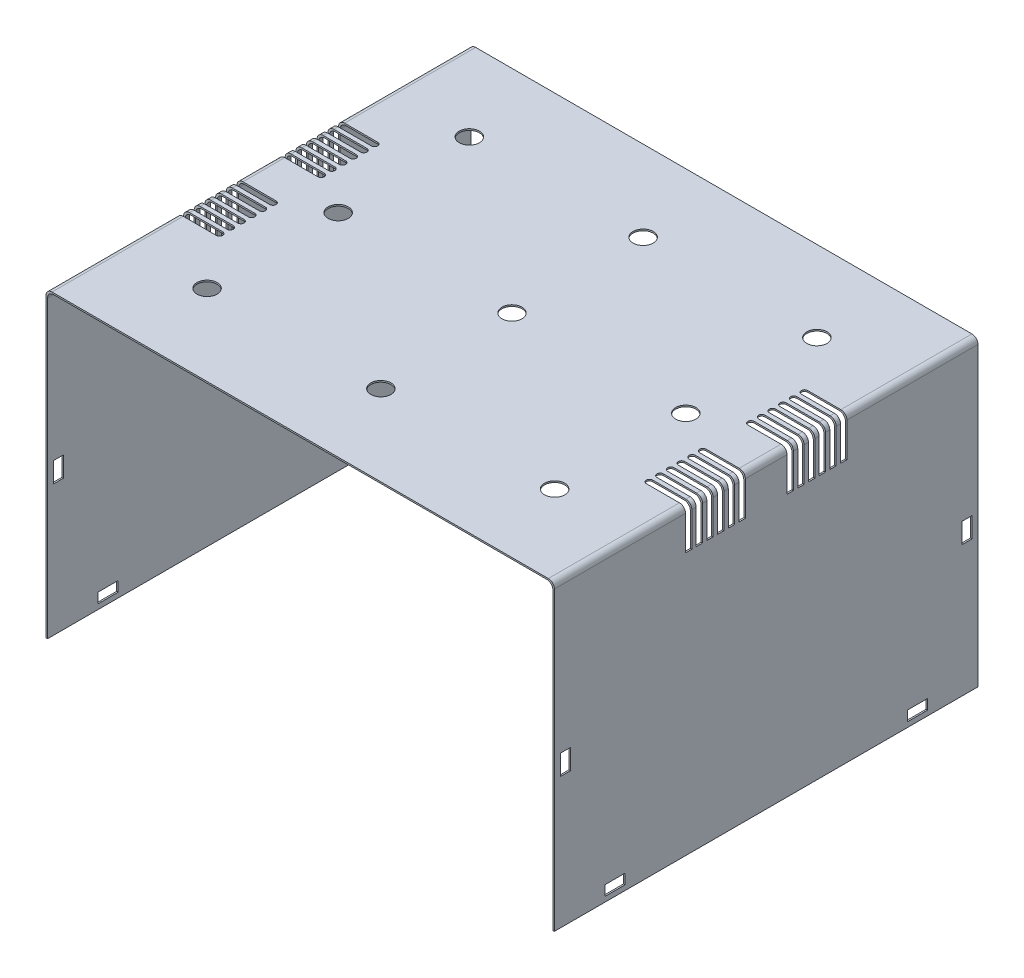
from build123d import *

# Parameters (mm, degrees)
SALIENTE_EXTRUIR1_DEPTH = 210
CORTAR_EXTRUIR3_DEPTH   = 20
CROQUIS5_W              = 10
CROQUIS5_H              = 5
CROQUIS5_W_2            = 5
CROQUIS5_H_2            = 10
CORTAR_EXTRUIR4_DEPTH   = 271
CROQUIS6_R              = 5
CORTAR_EXTRUIR5_DEPTH   = 10


with BuildPart() as part:
    # Croquis1 → Saliente-Extruir1 (new body)
    with BuildSketch(Plane.XY):
        with BuildLine():
            Line((-126, 0), (-126, 147))
            ThreePointArc((-126, 147), (-125.121320344, 149.121320344), (-123, 150))
            Line((-123, 150), (123, 150))
            ThreePointArc((123, 150), (125.121320344, 149.121320344), (126, 147))
            Line((126, 147), (126, 0))
            Line((126, 0), (125.25, 0))
            Line((125.25, 0), (125.25, 146.25))
            ThreePointArc((125.25, 146.25), (124.371320344, 148.371320344), (122.25, 149.25))
            Line((122.25, 149.25), (-122.25, 149.25))
            ThreePointArc((-122.25, 149.25), (-124.371320344, 148.371320344), (-125.25, 146.25))
            Line((-125.25, 146.25), (-125.25, 0))
            Line((-125.25, 0), (-126, 0))
        make_face()
    extrude(amount=-SALIENTE_EXTRUIR1_DEPTH)

    # Croquis4 → Cortar-Extruir3 (cut)
    with BuildSketch(Plane(origin=(0, 150, 0), x_dir=(1, 0, 0), z_dir=(0, 1, 0))):
        with BuildLine():
            Line((-106.575, 94.65), (-128.425, 94.65))
            ThreePointArc((-128.425, 94.65), (-130, 93.075), (-128.425, 91.5))
            Line((-128.425, 91.5), (-106.575, 91.5))
            ThreePointArc((-106.575, 91.5), (-105, 93.075), (-106.575, 94.65))
        make_face()
        with BuildLine():
            Line((-106.575, 145), (-128.425, 145))
            ThreePointArc((-128.425, 145), (-130, 143.425), (-128.425, 141.85))
            Line((-128.425, 141.85), (-106.575, 141.85))
            ThreePointArc((-106.575, 141.85), (-105, 143.425), (-106.575, 145))
        make_face()
        with BuildLine():
            Line((-106.575, 89.35), (-128.425, 89.35))
            ThreePointArc((-128.425, 89.35), (-130, 87.775), (-128.425, 86.2))
            Line((-128.425, 86.2), (-106.575, 86.2))
            ThreePointArc((-106.575, 86.2), (-105, 87.775), (-106.575, 89.35))
        make_face()
        with BuildLine():
            Line((-106.575, 84.05), (-128.425, 84.05))
            ThreePointArc((-128.425, 84.05), (-130, 82.475), (-128.425, 80.9))
            Line((-128.425, 80.9), (-106.575, 80.9))
            ThreePointArc((-106.575, 80.9), (-105, 82.475), (-106.575, 84.05))
        make_face()
        with BuildLine():
            Line((-106.575, 78.75), (-128.425, 78.75))
            ThreePointArc((-128.425, 78.75), (-130, 77.175), (-128.425, 75.6))
            Line((-128.425, 75.6), (-106.575, 75.6))
            ThreePointArc((-106.575, 75.6), (-105, 77.175), (-106.575, 78.75))
        make_face()
        with BuildLine():
            Line((-106.575, 73.45), (-128.425, 73.45))
            ThreePointArc((-128.425, 73.45), (-130, 71.875), (-128.425, 70.3))
            Line((-128.425, 70.3), (-106.575, 70.3))
            ThreePointArc((-106.575, 70.3), (-105, 71.875), (-106.575, 73.45))
        make_face()
        with BuildLine():
            Line((-128.425, 136.55), (-106.575, 136.55))
            ThreePointArc((-106.575, 136.55), (-105, 138.125), (-106.575, 139.7))
            Line((-106.575, 139.7), (-128.425, 139.7))
            ThreePointArc((-128.425, 139.7), (-130, 138.125), (-128.425, 136.55))
        make_face()
        with BuildLine():
            Line((-128.425, 131.25), (-106.575, 131.25))
            ThreePointArc((-106.575, 131.25), (-105, 132.825), (-106.575, 134.4))
            Line((-106.575, 134.4), (-128.425, 134.4))
            ThreePointArc((-128.425, 134.4), (-130, 132.825), (-128.425, 131.25))
        make_face()
        with BuildLine():
            Line((-128.425, 125.95), (-106.575, 125.95))
            ThreePointArc((-106.575, 125.95), (-105, 127.525), (-106.575, 129.1))
            Line((-106.575, 129.1), (-128.425, 129.1))
            ThreePointArc((-128.425, 129.1), (-130, 127.525), (-128.425, 125.95))
        make_face()
        with BuildLine():
            Line((-128.425, 120.65), (-106.575, 120.65))
            ThreePointArc((-106.575, 120.65), (-105, 122.225), (-106.575, 123.8))
            Line((-106.575, 123.8), (-128.425, 123.8))
            ThreePointArc((-128.425, 123.8), (-130, 122.225), (-128.425, 120.65))
        make_face()
        with BuildLine():
            Line((-128.425, 115.35), (-106.575, 115.35))
            ThreePointArc((-106.575, 115.35), (-105, 116.925), (-106.575, 118.5))
            Line((-106.575, 118.5), (-128.425, 118.5))
            ThreePointArc((-128.425, 118.5), (-130, 116.925), (-128.425, 115.35))
        make_face()
        with BuildLine():
            Line((-106.575, 68.15), (-128.425, 68.15))
            ThreePointArc((-128.425, 68.15), (-130, 66.575), (-128.425, 65))
            Line((-128.425, 65), (-106.575, 65))
            ThreePointArc((-106.575, 65), (-105, 66.575), (-106.575, 68.15))
        make_face()
        with BuildLine():
            Line((106.575, 118.5), (128.425, 118.5))
            ThreePointArc((128.425, 118.5), (130, 116.925), (128.425, 115.35))
            Line((128.425, 115.35), (106.575, 115.35))
            ThreePointArc((106.575, 115.35), (105, 116.925), (106.575, 118.5))
        make_face()
        with BuildLine():
            Line((106.575, 123.8), (128.425, 123.8))
            ThreePointArc((128.425, 123.8), (130, 122.225), (128.425, 120.65))
            Line((128.425, 120.65), (106.575, 120.65))
            ThreePointArc((106.575, 120.65), (105, 122.225), (106.575, 123.8))
        make_face()
        with BuildLine():
            Line((106.575, 129.1), (128.425, 129.1))
            ThreePointArc((128.425, 129.1), (130, 127.525), (128.425, 125.95))
            Line((128.425, 125.95), (106.575, 125.95))
            ThreePointArc((106.575, 125.95), (105, 127.525), (106.575, 129.1))
        make_face()
        with BuildLine():
            Line((106.575, 134.4), (128.425, 134.4))
            ThreePointArc((128.425, 134.4), (130, 132.825), (128.425, 131.25))
            Line((128.425, 131.25), (106.575, 131.25))
            ThreePointArc((106.575, 131.25), (105, 132.825), (106.575, 134.4))
        make_face()
        with BuildLine():
            Line((106.575, 139.7), (128.425, 139.7))
            ThreePointArc((128.425, 139.7), (130, 138.125), (128.425, 136.55))
            Line((128.425, 136.55), (106.575, 136.55))
            ThreePointArc((106.575, 136.55), (105, 138.125), (106.575, 139.7))
        make_face()
        with BuildLine():
            Line((106.575, 145), (128.425, 145))
            ThreePointArc((128.425, 145), (130, 143.425), (128.425, 141.85))
            Line((128.425, 141.85), (106.575, 141.85))
            ThreePointArc((106.575, 141.85), (105, 143.425), (106.575, 145))
        make_face()
        with BuildLine():
            Line((128.425, 65), (106.575, 65))
            ThreePointArc((106.575, 65), (105, 66.575), (106.575, 68.15))
            Line((106.575, 68.15), (128.425, 68.15))
            ThreePointArc((128.425, 68.15), (130, 66.575), (128.425, 65))
        make_face()
        with BuildLine():
            Line((128.425, 70.3), (106.575, 70.3))
            ThreePointArc((106.575, 70.3), (105, 71.875), (106.575, 73.45))
            Line((106.575, 73.45), (128.425, 73.45))
            ThreePointArc((128.425, 73.45), (130, 71.875), (128.425, 70.3))
        make_face()
        with BuildLine():
            Line((128.425, 75.6), (106.575, 75.6))
            ThreePointArc((106.575, 75.6), (105, 77.175), (106.575, 78.75))
            Line((106.575, 78.75), (128.425, 78.75))
            ThreePointArc((128.425, 78.75), (130, 77.175), (128.425, 75.6))
        make_face()
        with BuildLine():
            Line((128.425, 80.9), (106.575, 80.9))
            ThreePointArc((106.575, 80.9), (105, 82.475), (106.575, 84.05))
            Line((106.575, 84.05), (128.425, 84.05))
            ThreePointArc((128.425, 84.05), (130, 82.475), (128.425, 80.9))
        make_face()
        with BuildLine():
            Line((128.425, 86.2), (106.575, 86.2))
            ThreePointArc((106.575, 86.2), (105, 87.775), (106.575, 89.35))
            Line((106.575, 89.35), (128.425, 89.35))
            ThreePointArc((128.425, 89.35), (130, 87.775), (128.425, 86.2))
        make_face()
        with BuildLine():
            Line((128.425, 91.5), (106.575, 91.5))
            ThreePointArc((106.575, 91.5), (105, 93.075), (106.575, 94.65))
            Line((106.575, 94.65), (128.425, 94.65))
            ThreePointArc((128.425, 94.65), (130, 93.075), (128.425, 91.5))
        make_face()
    extrude(amount=-CORTAR_EXTRUIR3_DEPTH, mode=Mode.SUBTRACT)

    # Croquis5 → Cortar-Extruir4 (cut)
    with BuildSketch(Plane(origin=(126, 0, 0), x_dir=(0, 0, -1), z_dir=(1, 0, 0))):
        with Locations((30, 5)):
            Rectangle(CROQUIS5_W, CROQUIS5_H)
        with Locations((180, 5)):
            Rectangle(CROQUIS5_W, CROQUIS5_H)
        with Locations((204.5, 70)):
            Rectangle(CROQUIS5_W_2, CROQUIS5_H_2)
        with Locations((5.5, 70)):
            Rectangle(CROQUIS5_W_2, CROQUIS5_H_2)
    extrude(amount=-CORTAR_EXTRUIR4_DEPTH, mode=Mode.SUBTRACT)

    # Croquis6 → Cortar-Extruir5 (cut)
    with BuildSketch(Plane(origin=(0, 150, 0), x_dir=(1, 0, 0), z_dir=(0, 1, 0))):
        with Locations(Location((-86.15, 105, 0), (0, 0, 270))):
            Circle(CROQUIS6_R)
        with Locations(Location((0, 105, 0), (0, 0, 270))):
            Circle(CROQUIS6_R)
        with Locations(Location((86.15, 105, 0), (0, 0, 270))):
            Circle(CROQUIS6_R)
        with Locations(Location((-86.15, 170, 0), (0, 0, 270))):
            Circle(CROQUIS6_R)
        with Locations(Location((-86.15, 40, 0), (0, 0, 270))):
            Circle(CROQUIS6_R)
        with Locations(Location((0, 170, 0), (0, 0, 270))):
            Circle(CROQUIS6_R)
        with Locations(Location((86.15, 170, 0), (0, 0, 270))):
            Circle(CROQUIS6_R)
        with Locations(Location((86.15, 40, 0), (0, 0, 270))):
            Circle(CROQUIS6_R)
        with Locations(Location((0, 40, 0), (0, 0, 270))):
            Circle(CROQUIS6_R)
    extrude(amount=-CORTAR_EXTRUIR5_DEPTH, mode=Mode.SUBTRACT)


solid = part.part
